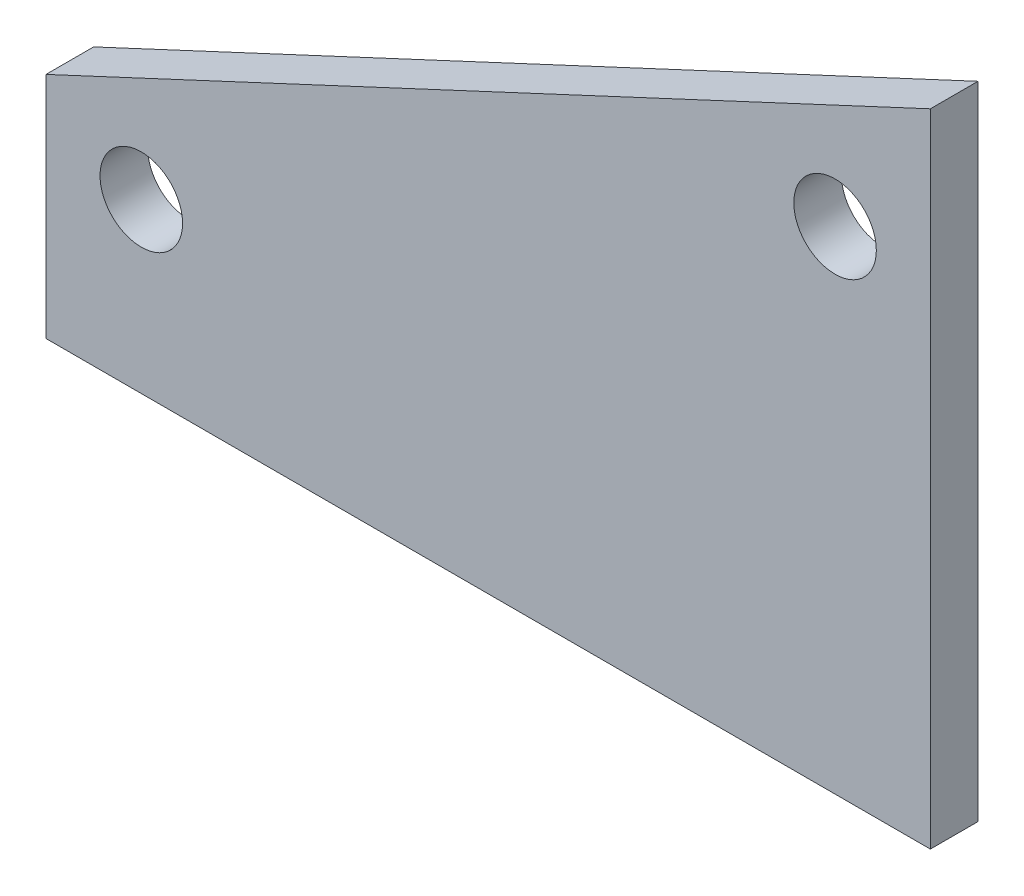
from build123d import *

# Parameters (mm, degrees)
SKETCH1_R           = 2.75
BOSS_EXTRUDE1_DEPTH = 3.175


with BuildPart() as part:
    # Sketch1 → Boss-Extrude1 (new body)
    with BuildSketch(Plane.XY):
        Polygon((-122.104796952, -176.121133645), (-122.104796952, -133.399898637), (-181.032796952, -160.878476317), (-181.032796952, -176.121133645), align=None)
        with Locations((-174.682796952, -164.923872473)):
            Circle(SKETCH1_R, mode=Mode.SUBTRACT)
        with Locations((-128.454796952, -143.370341124)):
            Circle(SKETCH1_R, mode=Mode.SUBTRACT)
    extrude(amount=-BOSS_EXTRUDE1_DEPTH)


solid = part.part
